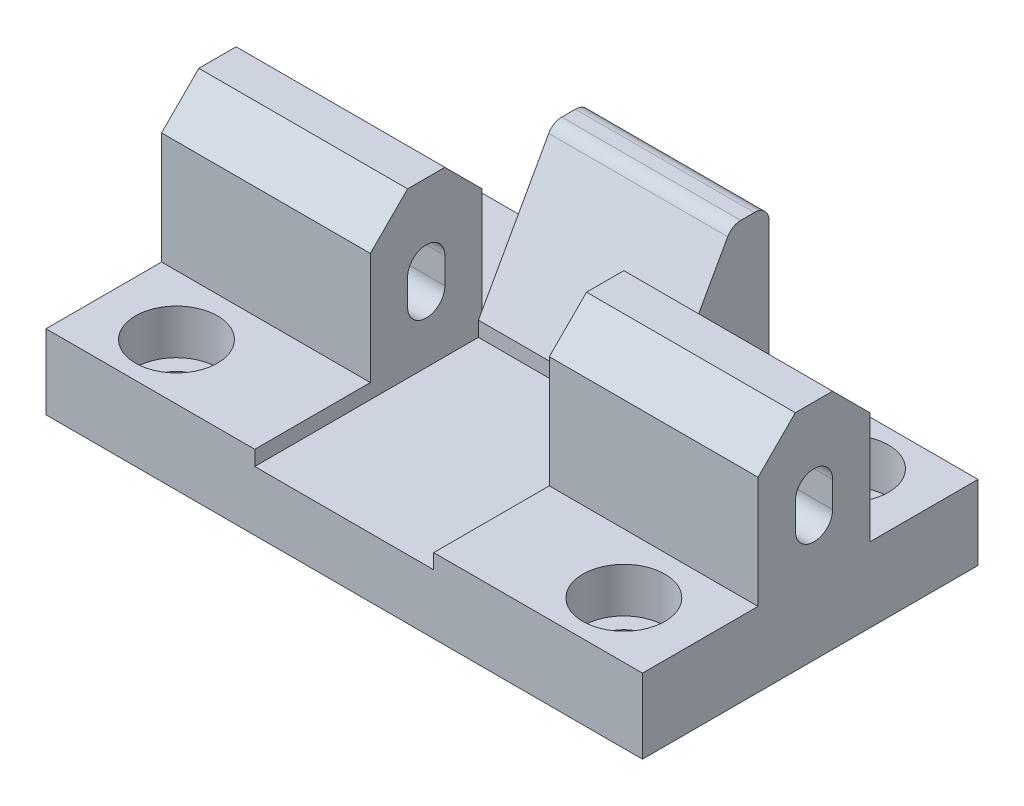
from build123d import *

# Parameters (mm, degrees)
SKETCH_2_W          = 80
SKETCH_2_H          = 45
EXTRUDE_1_DEPTH     = 10
EXTRUDE_2_DEPTH     = 12
FILLET_1_R          = 2
SKETCH_4_W          = 24
SKETCH_4_H          = 30
CUT_EXTRUDE_1_DEPTH = 2
SKETCH_5_W          = 28
SKETCH_5_H          = 15
EXTRUDE_3_DEPTH     = 20
CHAMFER_1_SIZE      = 5
CUT_EXTRUDE_2_DEPTH = 89.352985235
SKETCH_8_R          = 5.5
CUT_EXTRUDE_3_DEPTH = 6
SKETCH_9_R          = 3.25
CUT_EXTRUDE_4_DEPTH = 53.747037832


with BuildPart() as part:
    # 스케치2 → 보스-돌출1 (new body)
    with BuildSketch(Plane(origin=(0, 0, 0), x_dir=(1, 0, 0), z_dir=(0, 1, 0))):
        Rectangle(SKETCH_2_W, SKETCH_2_H)
    extrude(amount=EXTRUDE_1_DEPTH)

    # 스케치3 → 보스-돌출2 (add, symmetric)
    with BuildSketch(Plane(origin=(0, 0, 0), x_dir=(0, 0, -1), z_dir=(1, 0, 0))):
        Polygon((22.5, 10), (22.5, 28), (17.5, 28), (7.5, 10), align=None)
    extrude(amount=EXTRUDE_2_DEPTH, both=True)

    # 필렛1
    fillet_1_edges = [part.edges().sort_by_distance(p)[0] for p in [
        (0, 28, -22.5),
        (0, 28, -17.5),
    ]]
    fillet(fillet_1_edges, radius=FILLET_1_R)

    # 스케치4 → 컷-돌출1 (cut)
    with BuildSketch(Plane(origin=(0, 10, 0), x_dir=(1, 0, 0), z_dir=(0, 1, 0))):
        with Locations((0, -7.5)):
            Rectangle(SKETCH_4_W, SKETCH_4_H)
    extrude(amount=-CUT_EXTRUDE_1_DEPTH, mode=Mode.SUBTRACT)

    # 스케치5 → 보스-돌출3 (add)
    with BuildSketch(Plane(origin=(0, 10, 0), x_dir=(1, 0, 0), z_dir=(0, 1, 0))):
        with Locations((-26, 0.5)):
            Rectangle(SKETCH_5_W, SKETCH_5_H)
        with Locations((26, 0.5)):
            Rectangle(SKETCH_5_W, SKETCH_5_H)
    extrude(amount=EXTRUDE_3_DEPTH)

    # 모따기1
    chamfer_1_edges = [part.edges().sort_by_distance(p)[0] for p in [
        (-26, 30, 7),
        (-26, 30, -8),
        (26, 30, -8),
        (26, 30, 7),
    ]]
    chamfer(chamfer_1_edges, length=CHAMFER_1_SIZE)

    # 스케치6 → 컷-돌출2 (cut, through all)
    with BuildSketch(Plane(origin=(40, 0, 0), x_dir=(0, 0, -1), z_dir=(1, 0, 0))):
        with BuildLine():
            Line((3, 19.75), (3, 16.25))
            ThreePointArc((3, 16.25), (0.5, 13.75), (-2, 16.25))
            Line((-2, 16.25), (-2, 19.75))
            ThreePointArc((-2, 19.75), (0.5, 22.25), (3, 19.75))
        make_face()
    extrude(amount=-CUT_EXTRUDE_2_DEPTH, mode=Mode.SUBTRACT)

    # 스케치8 → 컷-돌출3 (cut)
    with BuildSketch(Plane(origin=(0, 10, 0), x_dir=(1, 0, 0), z_dir=(0, 1, 0))):
        with Locations(Location((-30, 15, 0), (0, 0, 270))):
            Circle(SKETCH_8_R)
        with Locations(Location((-30, -15, 0), (0, 0, 270))):
            Circle(SKETCH_8_R)
        with Locations(Location((30, -15, 0), (0, 0, 270))):
            Circle(SKETCH_8_R)
        with Locations(Location((30, 15, 0), (0, 0, 270))):
            Circle(SKETCH_8_R)
    extrude(amount=-CUT_EXTRUDE_3_DEPTH, mode=Mode.SUBTRACT)

    # 스케치9 → 컷-돌출4 (cut, through all)
    with BuildSketch(Plane(origin=(0, 4, 0), x_dir=(1, 0, 0), z_dir=(0, 1, 0))):
        with Locations(Location((-30, 15, 0), (0, 0, 270))):
            Circle(SKETCH_9_R)
        with Locations(Location((30, 15, 0), (0, 0, 270))):
            Circle(SKETCH_9_R)
        with Locations(Location((30, -15, 0), (0, 0, 270))):
            Circle(SKETCH_9_R)
        with Locations(Location((-30, -15, 0), (0, 0, 270))):
            Circle(SKETCH_9_R)
    extrude(amount=-CUT_EXTRUDE_4_DEPTH, mode=Mode.SUBTRACT)


solid = part.part
